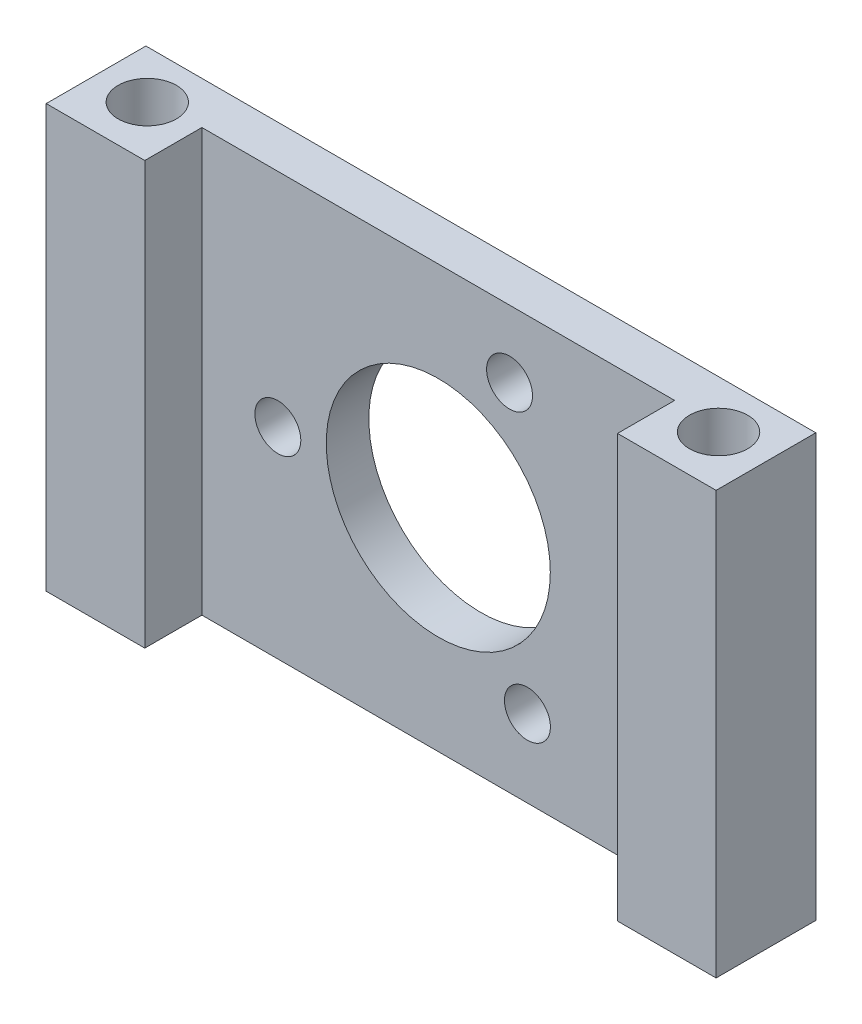
from build123d import *

# Parameters (mm, degrees)
SKETCH1_W           = 59.8
SKETCH1_H           = 37.7
BOSS_EXTRUDE1_DEPTH = 8.9
SKETCH2_W           = 42.2
SKETCH2_H           = 37.7
CUT_EXTRUDE1_DEPTH  = 5.1
SKETCH3_R           = 2.6
CUT_EXTRUDE2_DEPTH  = 49.933730698
SKETCH4_R           = 10
SKETCH4_R_2         = 2.05
CUT_EXTRUDE3_DEPTH  = 36.71193778


with BuildPart() as part:
    # Sketch1 → Boss-Extrude1 (new body)
    with BuildSketch(Plane.XY):
        Rectangle(SKETCH1_W, SKETCH1_H)
    extrude(amount=BOSS_EXTRUDE1_DEPTH)

    # Sketch2 → Cut-Extrude1 (cut)
    with BuildSketch(Plane.XY.offset(8.9)):
        Rectangle(SKETCH2_W, SKETCH2_H)
    extrude(amount=-CUT_EXTRUDE1_DEPTH, mode=Mode.SUBTRACT)

    # Sketch3 → Cut-Extrude2 (cut, through all)
    with BuildSketch(Plane(origin=(0, 18.85, 0), x_dir=(1, 0, 0), z_dir=(0, 1, 0))):
        with Locations(Location((25.5, -4.278740656, 0), (0, 0, 270))):
            Circle(SKETCH3_R)
        with Locations(Location((-25.5, -4.278740656, 0), (0, 0, 90))):
            Circle(SKETCH3_R)
    extrude(amount=-CUT_EXTRUDE2_DEPTH, mode=Mode.SUBTRACT)

    # Sketch4 → Cut-Extrude3 (cut, through all)
    with BuildSketch(Plane.XY.offset(3.8)):
        Circle(SKETCH4_R)
        with Locations((7.957753458, -11.941384338)):
            Circle(SKETCH4_R_2)
        with Locations((-14.320418922, -0.920924483)):
            Circle(SKETCH4_R_2)
        with Locations((6.362665464, 12.862308821)):
            Circle(SKETCH4_R_2)
    extrude(amount=-CUT_EXTRUDE3_DEPTH, mode=Mode.SUBTRACT)


solid = part.part
